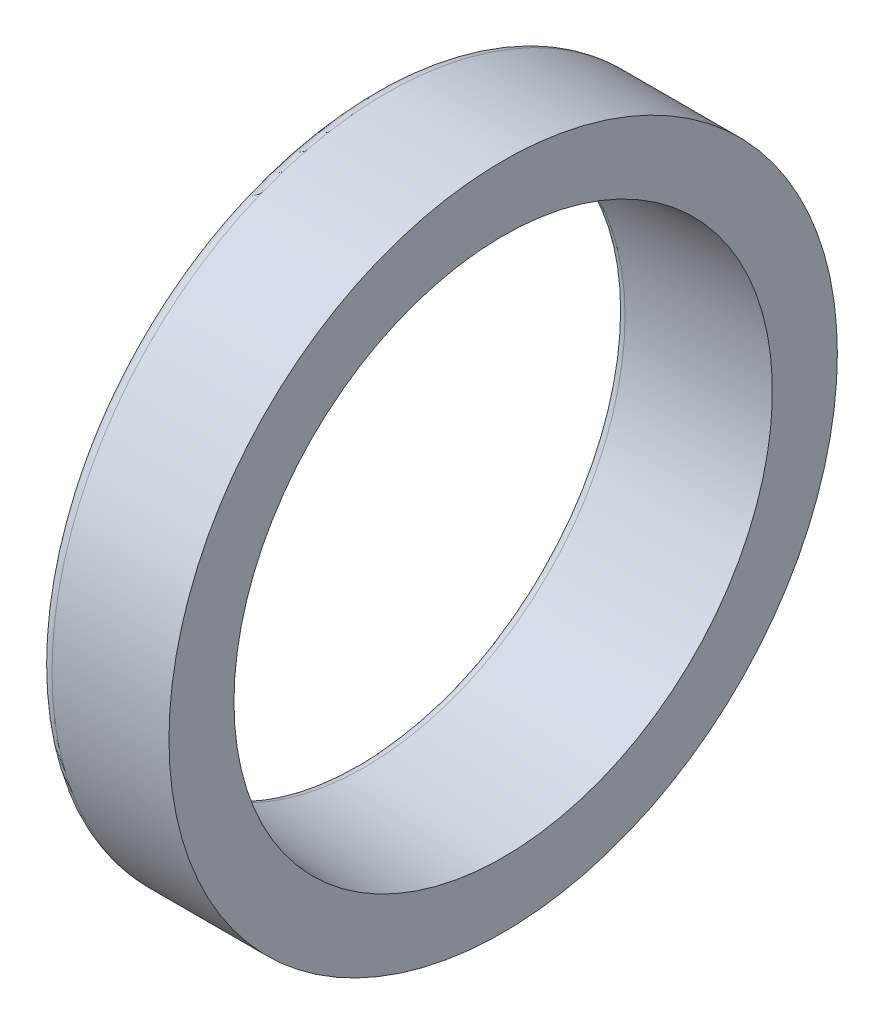
from build123d import *

# Parameters (mm, degrees)
ZAOKR_GLENIE1_R = 0.5


with BuildPart() as part:
    # Szkic1 → Obrót1 (revolve)
    with BuildSketch(Plane.XY, mode=Mode.PRIVATE) as obr_t1_sk:
        with BuildLine():
            Line((1, 18), (1, 14.5))
            Line((1, 14.5), (-7, 14))
            Line((-7, 14), (-7, 15))
            Line((-7, 15), (-5.220070867, 15.204578305))
            ThreePointArc((-5.220070867, 15.204578305), (-4.601145514, 15.940030073), (-5.3, 16.6))
            ThreePointArc((-5.3, 16.6), (-6, 17.3), (-5.3, 18))
            Line((-5.3, 18), (1, 18))
        make_face()
    revolve(obr_t1_sk.sketch.rotate(Axis((-14.021409336, 0, 0), (1, 0, 0)), 90), axis=Axis((-14.021409336, 0, 0), (1, 0, 0)))

    # Zaokrąglenie1
    zaokr_glenie1_edges = [part.edges().sort_by_distance(p)[0] for p in [
        (-7, 0, -14),
        (-7, 0, -15),
    ]]
    fillet(zaokr_glenie1_edges, radius=ZAOKR_GLENIE1_R)


solid = part.part
